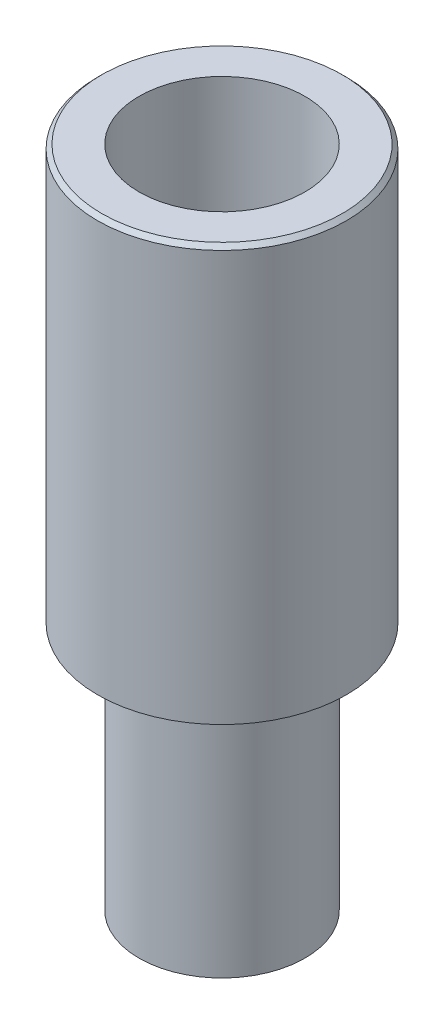
from build123d import *

# Parameters (mm, degrees)
SKETCH1_R           = 2
BOSS_EXTRUDE1_DEPTH = 6
SKETCH2_R           = 3
BOSS_EXTRUDE2_DEPTH = 10
CUT_EXTRUDE1_START  = -6
SKETCH3_R           = 2
CUT_EXTRUDE1_DEPTH  = 6
CHAMFER1_SIZE       = 0.1


with BuildPart() as part:
    # Sketch1 → Boss-Extrude1 (new body)
    with BuildSketch(Plane(origin=(0, 0, 0), x_dir=(1, 0, 0), z_dir=(0, 1, 0))):
        with Locations(Location((0, 0, 0), (0, 0, 270))):
            Circle(SKETCH1_R)
    extrude(amount=BOSS_EXTRUDE1_DEPTH)

    # Sketch2 → Boss-Extrude2 (add)
    with BuildSketch(Plane(origin=(0, 6, 0), x_dir=(1, 0, 0), z_dir=(0, 1, 0))):
        with Locations(Location((0, 0, 0), (0, 0, 270))):
            Circle(SKETCH2_R)
    extrude(amount=BOSS_EXTRUDE2_DEPTH)

    # Sketch3 → Cut-Extrude1 (cut)
    with BuildSketch(Plane(origin=(0, 16, 0), x_dir=(1, 0, 0), z_dir=(0, 1, 0)).offset(CUT_EXTRUDE1_START)):
        with Locations(Location((0, 0, 0), (0, 0, 270))):
            Circle(SKETCH3_R)
    extrude(amount=CUT_EXTRUDE1_DEPTH, mode=Mode.SUBTRACT)

    # Chamfer1
    chamfer1_edges = [part.edges().sort_by_distance(p)[0] for p in [
        (0, 16, -3),
    ]]
    chamfer(chamfer1_edges, length=CHAMFER1_SIZE)


solid = part.part
